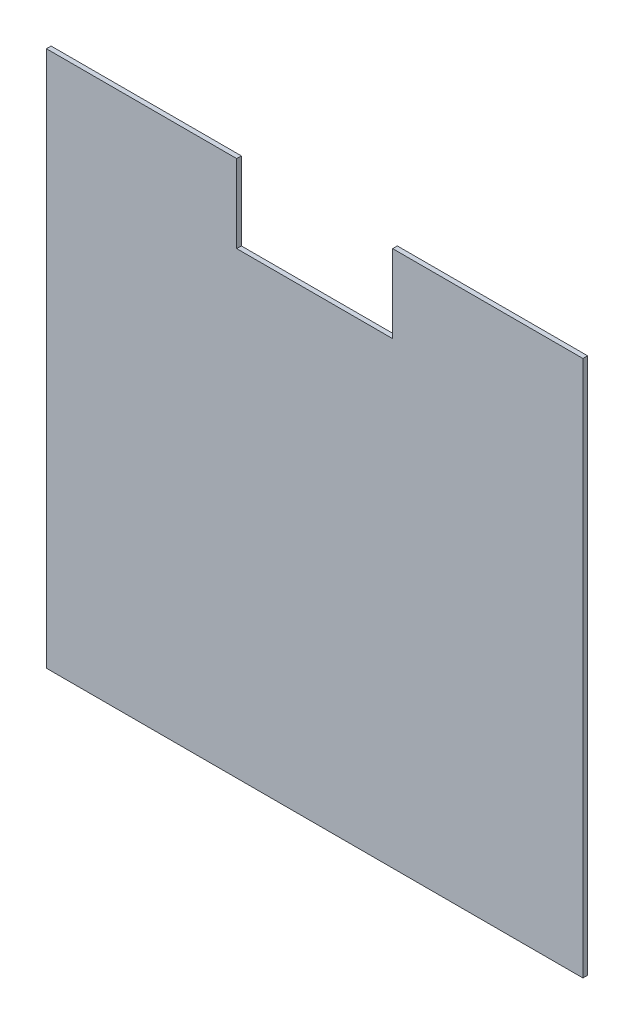
from build123d import *

# Parameters (mm, degrees)
ESTRUSIONE_ESTRUSIONE1_DEPTH = 3


with BuildPart() as part:
    # Schizzo1 → Estrusione-Estrusione1 (new body)
    with BuildSketch(Plane.XY):
        Polygon((0, 0), (0, 344), (122, 344), (122, 294), (222, 294), (222, 344), (344, 344), (344, 0), align=None)
    extrude(amount=ESTRUSIONE_ESTRUSIONE1_DEPTH)


solid = part.part
